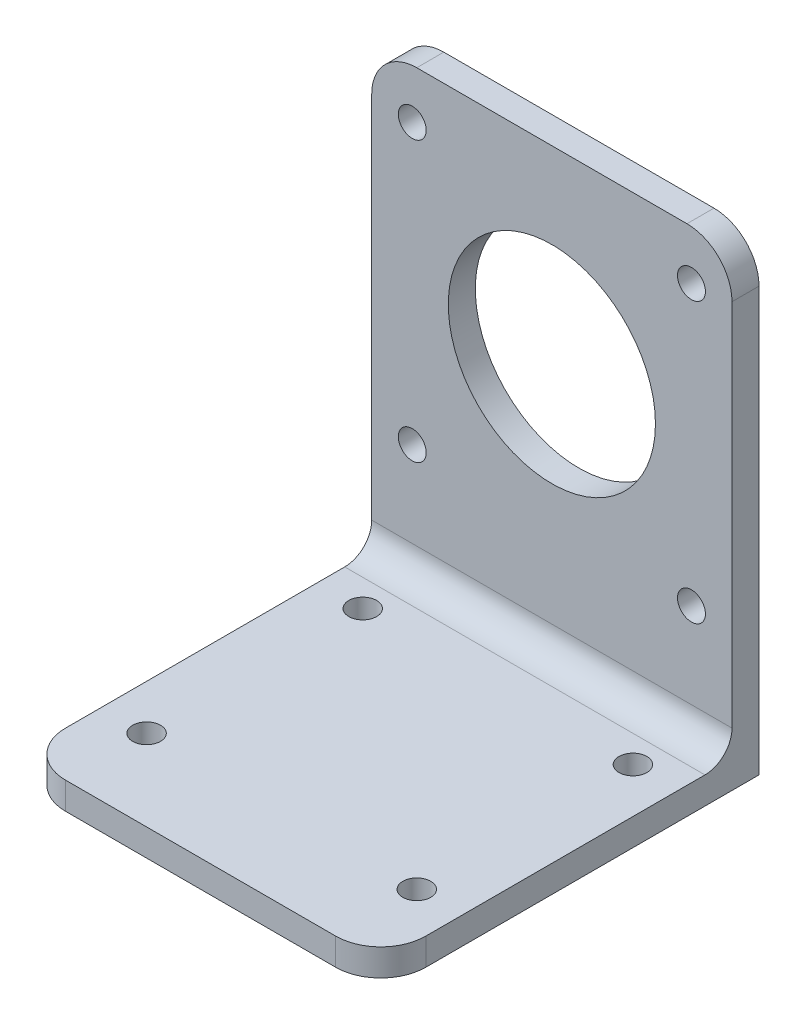
from build123d import *

# Parameters (mm, degrees)
SKETCH_1_W          = 40
SKETCH_1_H          = 42
SKETCH_1_R          = 1.55
EXTRUDE_1_DEPTH     = 3
SKETCH_2_W          = 40
SKETCH_2_H          = 3
EXTRUDE_2_DEPTH     = 49
SKETCH_3_R          = 11.5
SKETCH_3_R_2        = 1.55
CUT_EXTRUDE_1_DEPTH = 49
FILLET_1_R          = 5
FILLET_2_R          = 3


with BuildPart() as part:
    # 草图1 → 凸台-拉伸1 (new body)
    with BuildSketch(Plane(origin=(0, 0, 0), x_dir=(1, 0, 0), z_dir=(0, 1, 0))):
        Rectangle(SKETCH_1_W, SKETCH_1_H)
        with Locations(Location((-15, -12, 0), (0, 0, 270))):
            Circle(SKETCH_1_R, mode=Mode.SUBTRACT)
        with Locations(Location((-15, 12, 0), (0, 0, 270))):
            Circle(SKETCH_1_R, mode=Mode.SUBTRACT)
        with Locations(Location((15, 12, 0), (0, 0, 270))):
            Circle(SKETCH_1_R, mode=Mode.SUBTRACT)
        with Locations(Location((15, -12, 0), (0, 0, 270))):
            Circle(SKETCH_1_R, mode=Mode.SUBTRACT)
    extrude(amount=EXTRUDE_1_DEPTH)

    # 草图2 → 凸台-拉伸2 (add)
    with BuildSketch(Plane(origin=(0, 3, 0), x_dir=(1, 0, 0), z_dir=(0, 1, 0))):
        with Locations((0, 19.5)):
            Rectangle(SKETCH_2_W, SKETCH_2_H)
    extrude(amount=EXTRUDE_2_DEPTH)

    # 草图3 → 切除-拉伸1 (cut)
    with BuildSketch(Plane.XY.offset(-18)):
        with Locations((0, 31)):
            Circle(SKETCH_3_R)
        with Locations((-15.5, 46.5)):
            Circle(SKETCH_3_R_2)
        with Locations((15.5, 46.5)):
            Circle(SKETCH_3_R_2)
        with Locations((15.5, 15.5)):
            Circle(SKETCH_3_R_2)
        with Locations((-15.5, 15.5)):
            Circle(SKETCH_3_R_2)
    extrude(amount=-CUT_EXTRUDE_1_DEPTH, mode=Mode.SUBTRACT)

    # 圆角1
    fillet_1_edges = [part.edges().sort_by_distance(p)[0] for p in [
        (-20, 52, -19.5),
        (20, 52, -19.5),
        (20, 1.5, 21),
        (-20, 1.5, 21),
    ]]
    fillet(fillet_1_edges, radius=FILLET_1_R)

    # 圆角2
    fillet_2_edges = [part.edges().sort_by_distance(p)[0] for p in [
        (0, 3, -18),
    ]]
    fillet(fillet_2_edges, radius=FILLET_2_R)


solid = part.part
